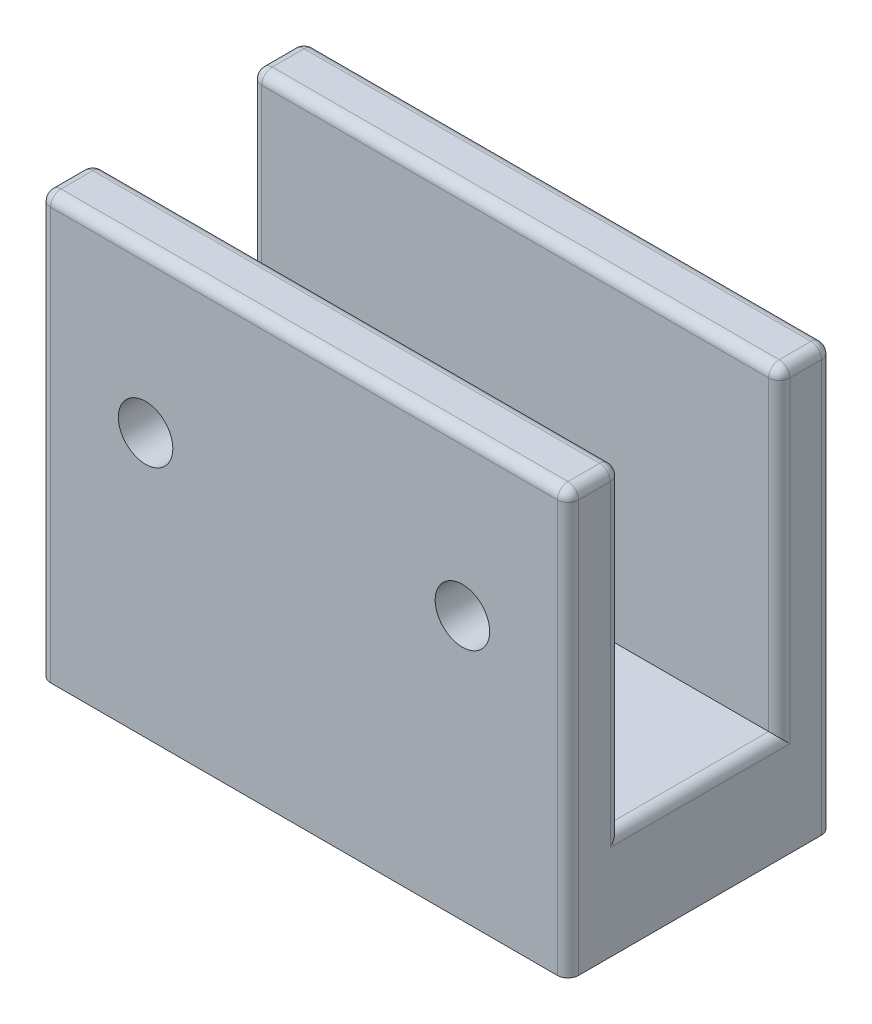
from build123d import *

# Parameters (mm, degrees)
SKETCH1_W           = 50
SKETCH1_H           = 25
BOSS_EXTRUDE1_DEPTH = 40
SKETCH2_W           = 50
SKETCH2_H           = 15
CUT_EXTRUDE1_DEPTH  = 30
FILLET1_R           = 1
CUT_EXTRUDE2_REACH  = 55.385
SKETCH3_R           = 2.5796875
SKETCH3_R_2         = 2.579687
SKETCH4_R           = 2.57968
CUT_EXTRUDE3_DEPTH  = 8


with BuildPart() as part:
    # Sketch1 → Boss-Extrude1 (new body)
    with BuildSketch(Plane(origin=(0, 0, 0), x_dir=(1, 0, 0), z_dir=(0, 1, 0))):
        Rectangle(SKETCH1_W, SKETCH1_H)
    extrude(amount=BOSS_EXTRUDE1_DEPTH)

    # Sketch2 → Cut-Extrude1 (cut)
    with BuildSketch(Plane(origin=(0, 40, 0), x_dir=(1, 0, 0), z_dir=(0, 1, 0))):
        Rectangle(SKETCH2_W, SKETCH2_H)
    extrude(amount=-CUT_EXTRUDE1_DEPTH, mode=Mode.SUBTRACT)

    # Fillet1
    fillet1_edges = [part.edges().sort_by_distance(p)[0] for p in [
        (-25, 40, -10),
        (0, 40, 12.5),
        (25, 40, -10),
        (-25, 40, 10),
        (25, 10, 0),
        (25, 25, -7.5),
        (25, 25, 7.5),
        (-25, 10, 0),
        (-25, 25, 7.5),
        (-25, 25, -7.5),
        (0, 40, -7.5),
        (0, 40, 7.5),
        (25, 40, 10),
        (0, 40, -12.5),
        (25, 20, 12.5),
        (-25, 20, 12.5),
        (-25, 20, -12.5),
        (25, 20, -12.5),
    ]]
    fillet(fillet1_edges, radius=FILLET1_R)

    # Sketch3 → Cut-Extrude2 (cut, up to next)
    with BuildSketch(Plane.XY.offset(12.5), mode=Mode.PRIVATE) as cut_extrude2_sk1:
        with Locations((-15, 25)):
            Circle(SKETCH3_R)
    cut_extrude2_tool1 = extrude(cut_extrude2_sk1.sketch, amount=-CUT_EXTRUDE2_REACH, mode=Mode.PRIVATE) & part.part
    # Sketch3 → Cut-Extrude2 (cut, up to next)
    with BuildSketch(Plane.XY.offset(12.5), mode=Mode.PRIVATE) as cut_extrude2_sk2:
        with Locations((15, 25)):
            Circle(SKETCH3_R_2)
    cut_extrude2_tool2 = extrude(cut_extrude2_sk2.sketch, amount=-CUT_EXTRUDE2_REACH, mode=Mode.PRIVATE) & part.part
    add(cut_extrude2_tool1.solids().sort_by_distance((-15, 25, 12.5))[0], mode=Mode.SUBTRACT)
    add(cut_extrude2_tool2.solids().sort_by_distance((15, 25, 12.5))[0], mode=Mode.SUBTRACT)

    # Sketch4 → Cut-Extrude3 (cut)
    with BuildSketch(Plane(origin=(0, 0, 0), x_dir=(-1, 0, 0), z_dir=(0, -1, 0))):
        with Locations(Location((0, 0, 0), (0, 0, 90))):
            Circle(SKETCH4_R)
    extrude(amount=-CUT_EXTRUDE3_DEPTH, mode=Mode.SUBTRACT)


solid = part.part
